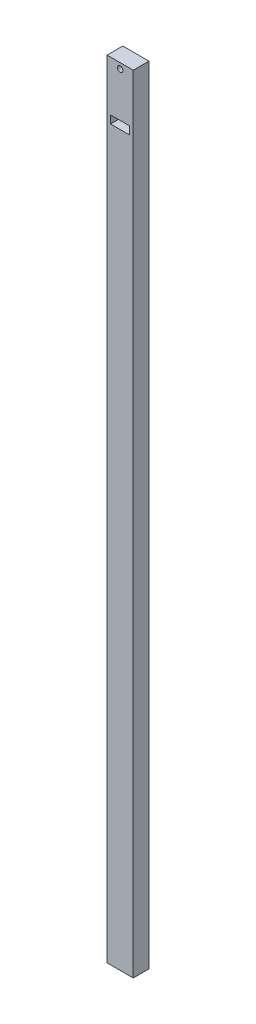
from build123d import *

# Parameters (mm, degrees)
SKETCH1_W           = 10
SKETCH1_H           = 300
SKETCH1_R           = 1.06
SKETCH1_W_2         = 7.32
SKETCH1_H_2         = 3
BOSS_EXTRUDE1_DEPTH = 6


with BuildPart() as part:
    # Sketch1 → Boss-Extrude1 (new body)
    with BuildSketch(Plane.XY):
        with Locations((5, 150)):
            Rectangle(SKETCH1_W, SKETCH1_H)
        with Locations((5, 297.9)):
            Circle(SKETCH1_R, mode=Mode.SUBTRACT)
        with Locations((5, 279.4)):
            Rectangle(SKETCH1_W_2, SKETCH1_H_2, mode=Mode.SUBTRACT)
    extrude(amount=BOSS_EXTRUDE1_DEPTH)


solid = part.part
